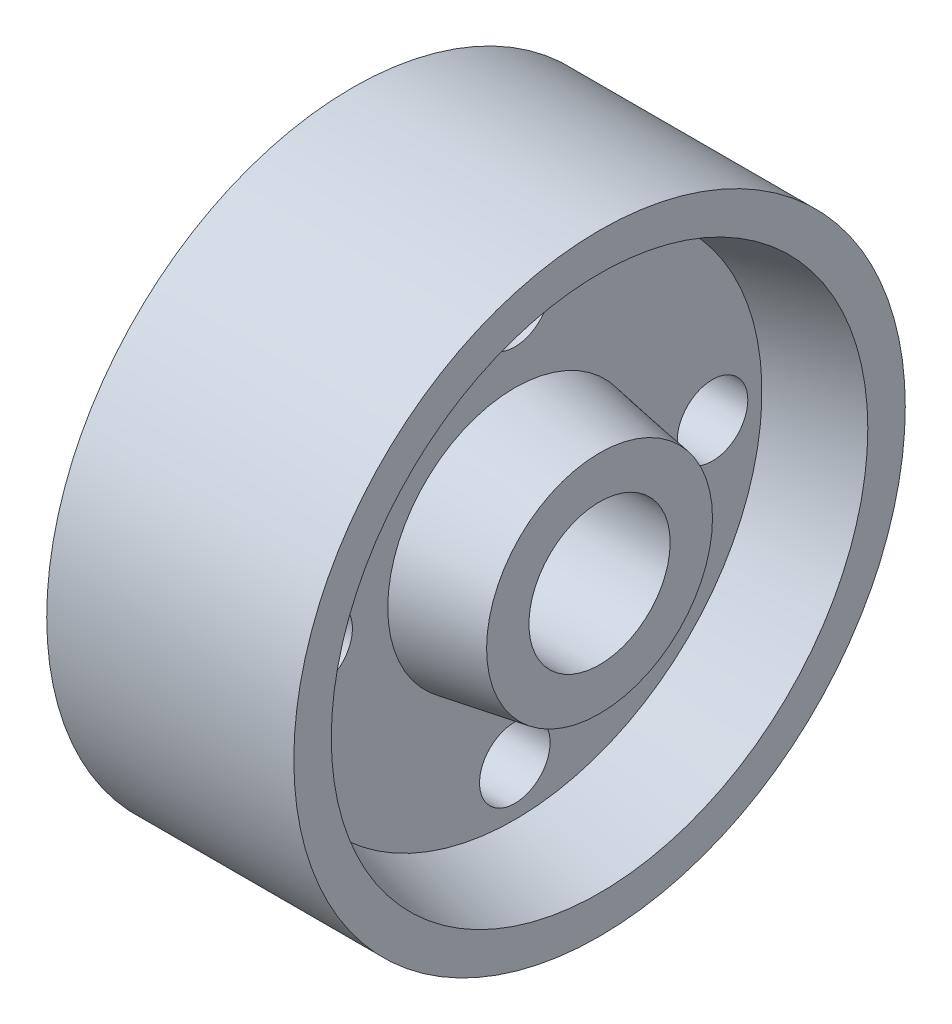
from build123d import *

# Parameters (mm, degrees)
SKETCH2_R          = 5
CUT_EXTRUDE1_DEPTH = 66.421885576
SKETCH3_R          = 10
CUT_EXTRUDE2_DEPTH = 71.540932177


with BuildPart() as part:
    # Sketch1 → Revolve1 (revolve)
    with BuildSketch(Plane(origin=(0, 0, 0), x_dir=(1, 0, 0), z_dir=(0, 1, 0)), mode=Mode.PRIVATE) as revolve1_sk:
        Polygon((0, 0), (0, 16), (12, 18), (12, 35), (0, 38), (0, 43.307176728), (35, 43.307176728), (35, 38), (23, 35), (23, 18), (35, 16), (35, 0), align=None)
    revolve(revolve1_sk.sketch.rotate(Axis((0, 0, 0), (1, 0, 0)), 180), axis=Axis((0, 0, 0), (1, 0, 0)))

    # Sketch2 → Cut-Extrude1 (cut, through all)
    with BuildSketch(Plane(origin=(23, 0, 0), x_dir=(0, 0, -1), z_dir=(1, 0, 0))):
        with Locations((0, 28)):
            Circle(SKETCH2_R)
        with Locations((28, 0)):
            Circle(SKETCH2_R)
        with Locations((0, -28)):
            Circle(SKETCH2_R)
        with Locations((-28, 0)):
            Circle(SKETCH2_R)
    extrude(amount=-CUT_EXTRUDE1_DEPTH, mode=Mode.SUBTRACT)

    # Sketch3 → Cut-Extrude2 (cut, through all)
    with BuildSketch(Plane(origin=(35, 0, 0), x_dir=(0, 0, -1), z_dir=(1, 0, 0))):
        Circle(SKETCH3_R)
    extrude(amount=-CUT_EXTRUDE2_DEPTH, mode=Mode.SUBTRACT)


solid = part.part
